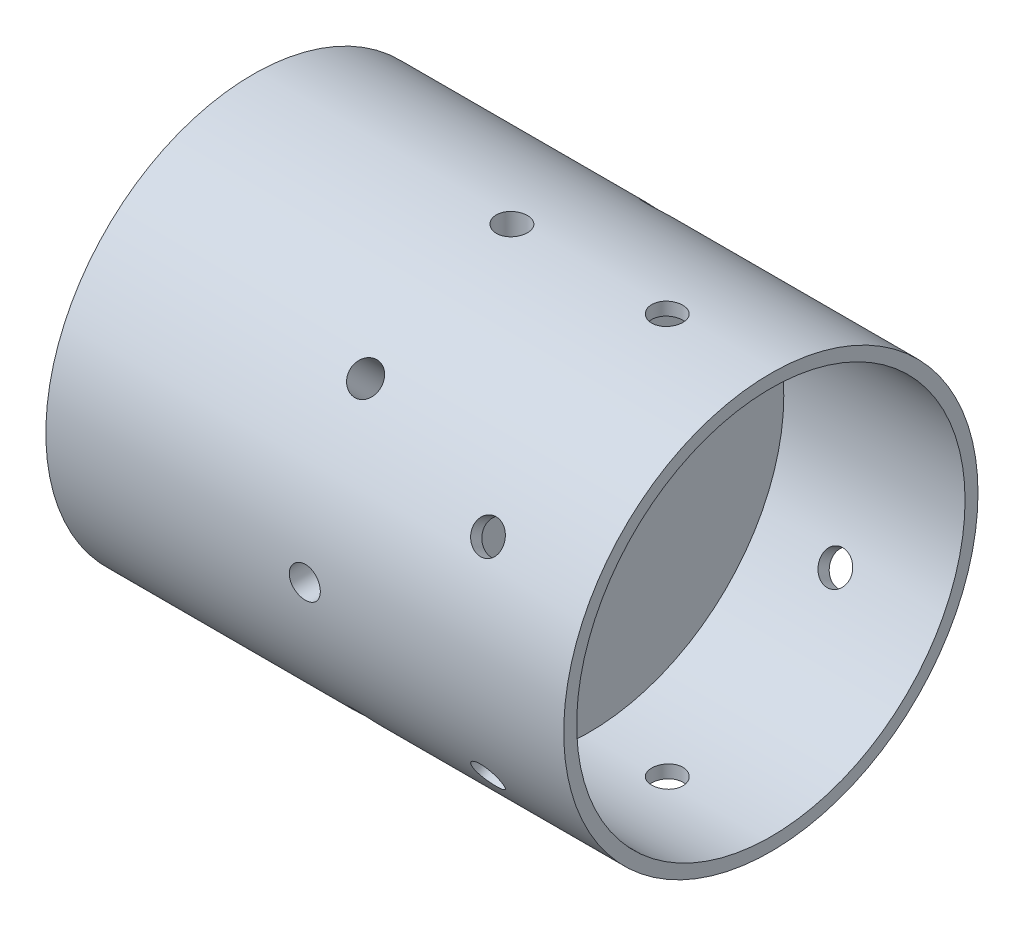
from build123d import *

# Parameters (mm, degrees)
SKETCH1_R               = 40
BOSS_EXTRUDE1_DEPTH     = 50
SKETCH4_R               = 3
CUT_EXTRUDE2_DEPTH      = 15
CIRPATTERN1_COUNT       = 8
SKETCH5_R               = 2.5
CUT_EXTRUDE5_DEPTH      = 15
SKETCH6_R               = 37.5
CUT_EXTRUDE6_DEPTH      = 35
CUT_EXTRUDE9_REACH      = 104.47
CUT_EXTRUDE9_END_RADIUS = 37.5
SKETCH7_R               = 3
CIRPATTERN3_COUNT       = 6


with BuildPart() as part:
    # Sketch1 → Boss-Extrude1 (new, symmetric)
    with BuildSketch(Plane(origin=(0, 0, 0), x_dir=(0, 0, -1), z_dir=(1, 0, 0))):
        Circle(SKETCH1_R)
    extrude(amount=BOSS_EXTRUDE1_DEPTH, both=True)

    # Sketch4 → Cut-Extrude2 (cut)
    with BuildSketch(Plane(origin=(0, 40, 0), x_dir=(1, 0, 0), z_dir=(0, 1, 0))):
        with Locations(Location((0, 0, 0), (0, 0, 270))):
            Circle(SKETCH4_R)
    cut_extrude2 = extrude(amount=-CUT_EXTRUDE2_DEPTH, mode=Mode.SUBTRACT)

    # CirPattern1: Cut-Extrude2 ×8 about axis
    cirpattern1_axis = Axis((0, 0, 0), (1, 0, 0))
    for i in range(1, CIRPATTERN1_COUNT):
        add(cut_extrude2.rotate(cirpattern1_axis, i * 360 / CIRPATTERN1_COUNT), mode=Mode.SUBTRACT)

    # Sketch5 → Cut-Extrude5 (cut)
    with BuildSketch(Plane.ZY.offset(50)):
        with Locations((14.852428205, 26.06540574)):
            Circle(SKETCH5_R)
        with Locations((29.999517634, 0.170122737)):
            Circle(SKETCH5_R)
        with Locations((15.147089429, -25.895283004)):
            Circle(SKETCH5_R)
        with Locations((-14.852428205, -26.06540574)):
            Circle(SKETCH5_R)
        with Locations((-29.999517634, -0.170122737)):
            Circle(SKETCH5_R)
        with Locations((-15.147089429, 25.895283004)):
            Circle(SKETCH5_R)
    extrude(amount=-CUT_EXTRUDE5_DEPTH, mode=Mode.SUBTRACT)

    # Sketch6 → Cut-Extrude6 (cut)
    with BuildSketch(Plane(origin=(50, 0, 0), x_dir=(0, 0, -1), z_dir=(1, 0, 0))):
        Circle(SKETCH6_R)
    extrude(amount=-CUT_EXTRUDE6_DEPTH, mode=Mode.SUBTRACT)

    # Cut-Extrude9: up to this cylinder (the profile starts outside it)
    cut_extrude9_end = Plane(origin=(30, 0, 0), z_dir=(1, 0, 0)) * Cylinder(CUT_EXTRUDE9_END_RADIUS, 284.94, mode=Mode.PRIVATE)
    # Sketch7 → Cut-Extrude9 (cut, up to the surface)
    with BuildSketch(Plane(origin=(0, 40, 0), x_dir=(1, 0, 0), z_dir=(0, 1, 0)), mode=Mode.PRIVATE) as cut_extrude9_sk1:
        with Locations(Location((30, 0, 0), (0, 0, 270))):
            Circle(SKETCH7_R)
    cut_extrude9_tool1 = extrude(cut_extrude9_sk1.sketch, amount=-CUT_EXTRUDE9_REACH, mode=Mode.PRIVATE) - cut_extrude9_end
    cut_extrude9 = cut_extrude9_tool1.solids().sort_by_distance((30, 40, 0))[0]
    add(cut_extrude9, mode=Mode.SUBTRACT)

    # CirPattern3: Cut-Extrude9 ×6 about axis
    cirpattern3_axis = Axis((50, 0, 0), (-1, 0, 0))
    for i in range(1, CIRPATTERN3_COUNT):
        add(cut_extrude9.rotate(cirpattern3_axis, i * 360 / CIRPATTERN3_COUNT), mode=Mode.SUBTRACT)


solid = part.part
